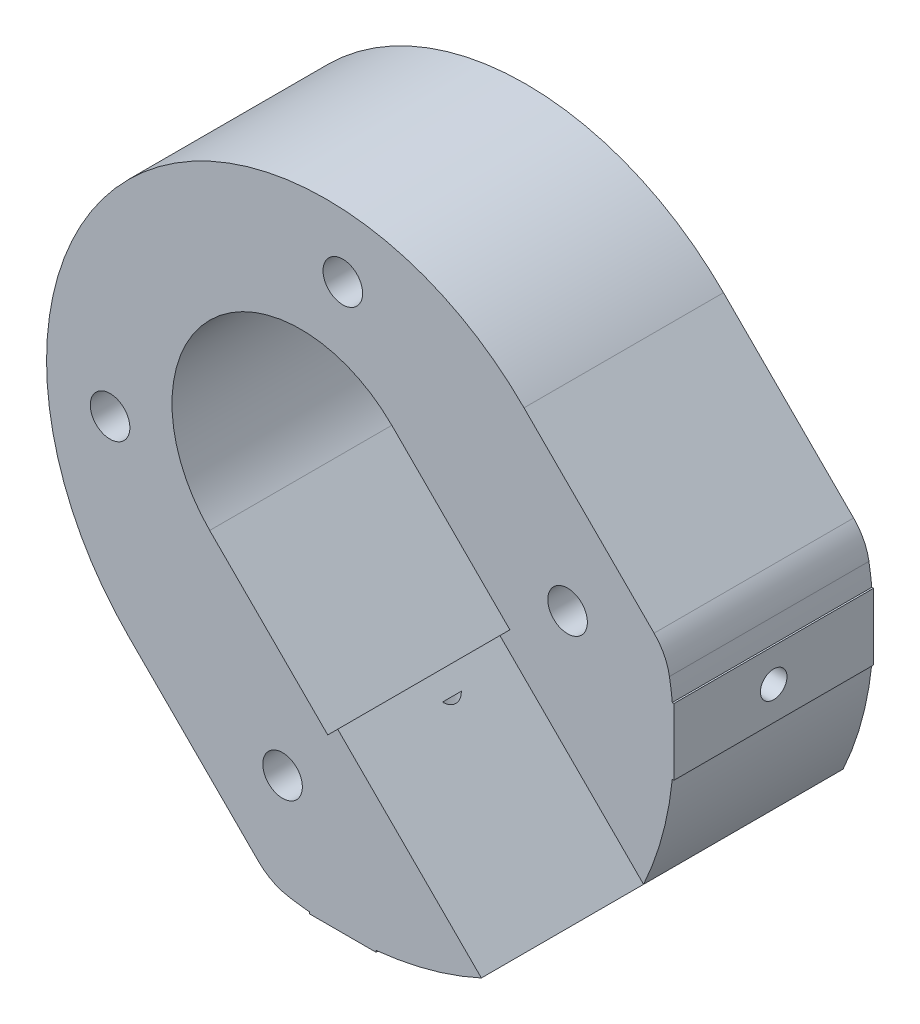
from build123d import *

# Parameters (mm, degrees)
BOSS_EXTRUDE1_DEPTH      = 15
BOSS_EXTRUDE1_DEPTH_BACK = 15
SKETCH2_R                = 2
CUT_EXTRUDE1_DEPTH       = 24
SKETCH3_R                = 2
CUT_EXTRUDE2_DEPTH       = 24
SKETCH6_R                = 2.9765625
CUT_EXTRUDE4_DEPTH       = 73.013836648


with BuildPart() as part:
    # Sketch1 → Boss-Extrude1 (new, two sides: drawn at the far end of the back side and taken through both)
    with BuildSketch(Plane.XY.offset(-BOSS_EXTRUDE1_DEPTH_BACK)):
        with BuildLine():
            Line((5, -49.80458146), (-5, -49.80458146))
            Line((-5, -49.80458146), (-5, -49.552964941))
            ThreePointArc((-5, -49.552964941), (-6.59229192, -49.366365287), (-8.177753112, -49.128613744))
            ThreePointArc((-8.177753112, -49.128613744), (-10.602641493, -48.324877157), (-12.666415249, -46.819249696))
            Line((-12.666415249, -46.819249696), (-32.231963719, -27.253701226))
            ThreePointArc((-32.231963719, -27.253701226), (-32.231963719, 32.231963719), (27.253701226, 32.231963719))
            Line((27.253701226, 32.231963719), (46.819249696, 12.666415249))
            ThreePointArc((46.819249696, 12.666415249), (48.324877157, 10.602641493), (49.128613744, 8.177753112))
            ThreePointArc((49.128613744, 8.177753112), (49.366365287, 6.59229192), (49.552964941, 5))
            Line((49.552964941, 5), (49.80458146, 5))
            Line((49.80458146, 5), (49.80458146, -5))
            Line((49.80458146, -5), (49.552964941, -5))
            ThreePointArc((49.552964941, -5), (48.051135901, -13.099033286), (45.234948365, -20.839764414))
            Line((45.234948365, -20.839764414), (23.63175062, 0.763433331))
            Line((23.63175062, 0.763433331), (25.128673235, 2.260355947))
            Line((25.128673235, 2.260355947), (7.371511647, 20.017517534))
            ThreePointArc((7.371511647, 20.017517534), (-20.017517534, 20.017517534), (-20.017517534, -7.371511647))
            Line((-20.017517534, -7.371511647), (-2.260355947, -25.128673235))
            Line((-2.260355947, -25.128673235), (-0.763433331, -23.63175062))
            Line((-0.763433331, -23.63175062), (20.839764414, -45.234948365))
            ThreePointArc((20.839764414, -45.234948365), (13.099033286, -48.051135901), (5, -49.552964941))
            Line((5, -49.552964941), (5, -49.80458146))
        make_face()
    extrude(amount=BOSS_EXTRUDE1_DEPTH + BOSS_EXTRUDE1_DEPTH_BACK)

    # Sketch2 → Cut-Extrude1 (cut)
    with BuildSketch(Plane(origin=(0, -49.80458146, 0), x_dir=(1, 0, 0), z_dir=(0, 1, 0))):
        Circle(SKETCH2_R)
    extrude(amount=CUT_EXTRUDE1_DEPTH, mode=Mode.SUBTRACT)

    # Sketch3 → Cut-Extrude2 (cut)
    with BuildSketch(Plane(origin=(49.80458146, 0, 0), x_dir=(0, 0, -1), z_dir=(1, 0, 0))):
        Circle(SKETCH3_R)
    extrude(amount=-CUT_EXTRUDE2_DEPTH, mode=Mode.SUBTRACT)

    # Sketch6 → Cut-Extrude4 (cut, through all)
    with BuildSketch(Plane.XY):
        with Locations((-9.058666579, -33.80740392)):
            Circle(SKETCH6_R)
        with Locations((-35, 0)):
            Circle(SKETCH6_R)
        with Locations((0, 35)):
            Circle(SKETCH6_R)
        with Locations((33.80740392, 9.058666579)):
            Circle(SKETCH6_R)
    extrude(amount=CUT_EXTRUDE4_DEPTH, mode=Mode.SUBTRACT)


solid = part.part
